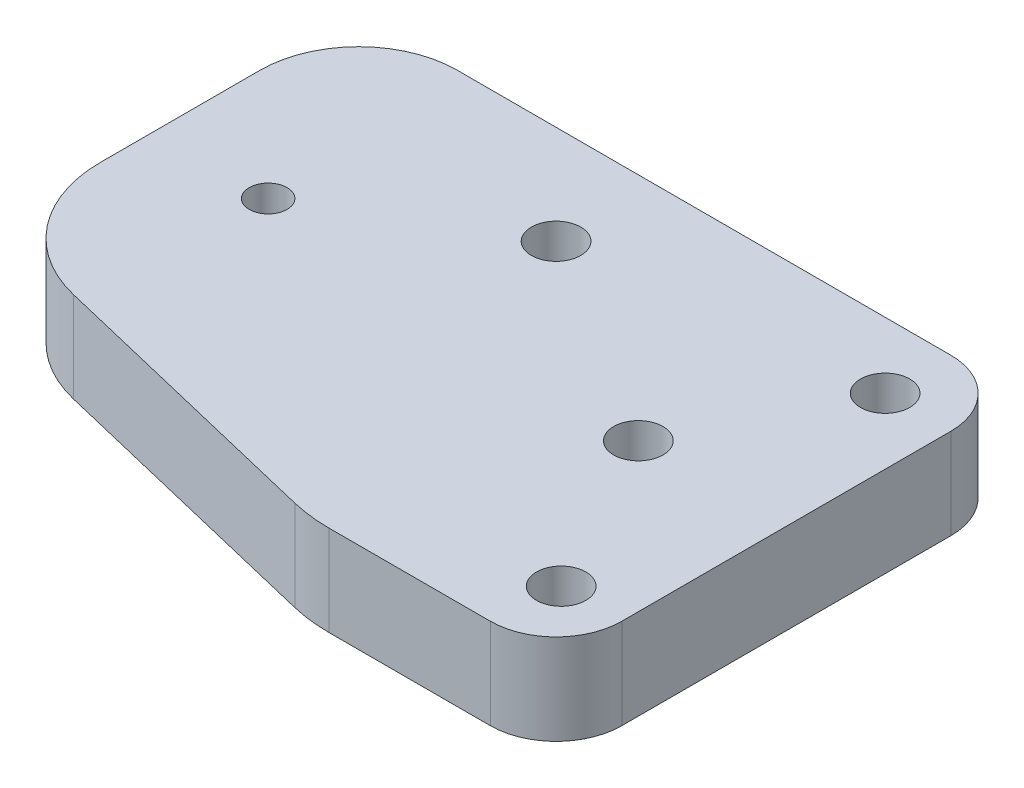
from build123d import *

# Parameters (mm, degrees)
SKETCH1_R           = 1.5
SKETCH1_R_2         = 1.15
BOSS_EXTRUDE1_DEPTH = 5.5
FILLET1_R           = 6
FILLET2_R           = 8
FILLET3_R           = 4
FILLET4_R           = 4
FILLET5_R           = 10


with BuildPart() as part:
    # Sketch1 → Boss-Extrude1 (new body)
    with BuildSketch(Plane(origin=(0, 0, 0), x_dir=(1, 0, 0), z_dir=(0, 1, 0))):
        Polygon((0, 16), (25, 10), (40, 10), (40, 38), (0, 38), align=None)
        with Locations(Location((36, 34, 0), (0, 0, 270))):
            Circle(SKETCH1_R, mode=Mode.SUBTRACT)
        with Locations(Location((36.311245585, 14, 0), (0, 0, 270))):
            Circle(SKETCH1_R, mode=Mode.SUBTRACT)
        with Locations(Location((31, 24, 0), (0, 0, 270))):
            Circle(SKETCH1_R, mode=Mode.SUBTRACT)
        with Locations(Location((18, 32, 0), (0, 0, 270))):
            Circle(SKETCH1_R, mode=Mode.SUBTRACT)
        with Locations(Location((7, 25.5, 0), (0, 0, 270))):
            Circle(SKETCH1_R_2, mode=Mode.SUBTRACT)
    extrude(amount=BOSS_EXTRUDE1_DEPTH)

    # Fillet1
    fillet1_edges = [part.edges().sort_by_distance(p)[0] for p in [
        (0, 2.75, -38),
    ]]
    fillet(fillet1_edges, radius=FILLET1_R)

    # Fillet2
    fillet2_edges = [part.edges().sort_by_distance(p)[0] for p in [
        (0, 2.75, -16),
    ]]
    fillet(fillet2_edges, radius=FILLET2_R)

    # Fillet3
    fillet3_edges = [part.edges().sort_by_distance(p)[0] for p in [
        (40, 2.75, -38),
    ]]
    fillet(fillet3_edges, radius=FILLET3_R)

    # Fillet4
    fillet4_edges = [part.edges().sort_by_distance(p)[0] for p in [
        (40, 2.75, -10),
    ]]
    fillet(fillet4_edges, radius=FILLET4_R)

    # Fillet5
    fillet5_edges = [part.edges().sort_by_distance(p)[0] for p in [
        (25, 2.75, -10),
    ]]
    fillet(fillet5_edges, radius=FILLET5_R)


solid = part.part
